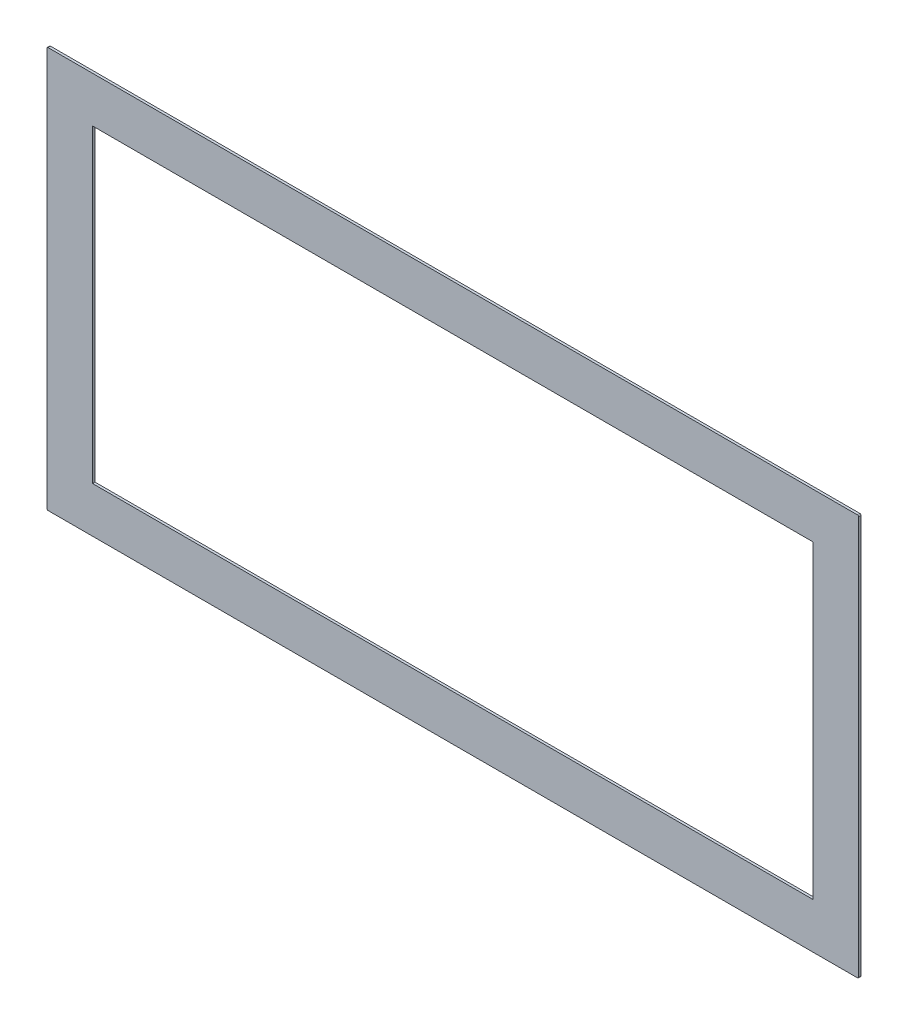
from build123d import *

# Parameters (mm, degrees)
SKETCH_1_W      = 292
SKETCH_1_H      = 125.5
EXTRUDE_1_DEPTH = 1


with BuildPart() as part:
    # 스케치1 → 보스-돌출1 (new body)
    with BuildSketch(Plane.XY):
        with BuildLine():
            Line((-328.5, 162.5), (-0.5, 162.5))
            ThreePointArc((-0.5, 162.5), (-0.146446609, 162.353553391), (0, 162))
            Line((0, 162), (0, 0.5))
            ThreePointArc((0, 0.5), (-0.146446609, 0.146446609), (-0.5, 0))
            Line((-0.5, 0), (-328.5, 0))
            ThreePointArc((-328.5, 0), (-328.853553391, 0.146446609), (-329, 0.5))
            Line((-329, 0.5), (-329, 162))
            ThreePointArc((-329, 162), (-328.853553391, 162.353553391), (-328.5, 162.5))
        make_face()
        with Locations((-164.5, 81.25)):
            Rectangle(SKETCH_1_W, SKETCH_1_H, mode=Mode.SUBTRACT)
    extrude(amount=EXTRUDE_1_DEPTH)


solid = part.part
